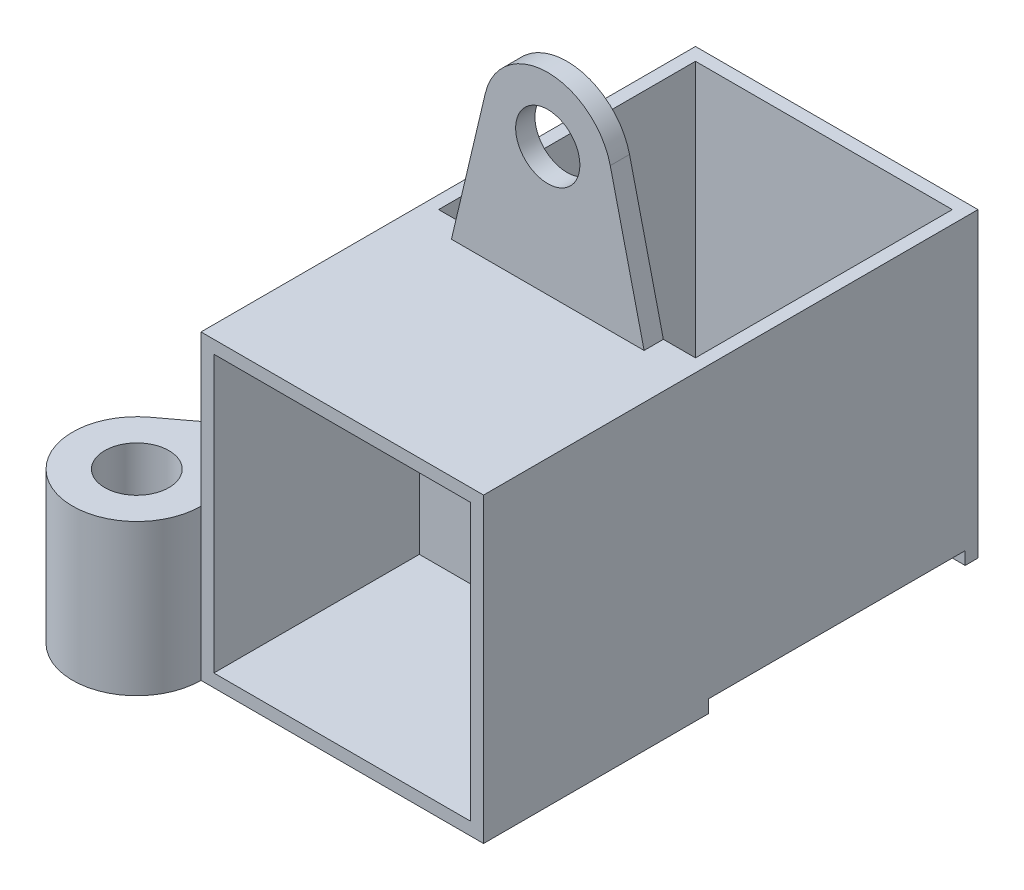
from build123d import *

# Parameters (mm, degrees)
SKETCH1_R                = 5
BOSS_EXTRUDE1_DEPTH      = 3
BOSS_EXTRUDE2_DEPTH      = 35
BOSS_EXTRUDE2_DEPTH_BACK = 40
BOSS_EXTRUDE2_START      = -3
SKETCH1_3_W              = 2
SKETCH1_3_H              = 45
SKETCH1_3_H_2            = 2
BOSS_EXTRUDE6_START      = -3
BOSS_EXTRUDE6_DEPTH      = 35
BOSS_EXTRUDE8_START      = -45
SKETCH1_7_W              = 44
SKETCH1_7_H              = 47
BOSS_EXTRUDE8_DEPTH      = 2
BOSS_EXTRUDE9_START      = -3
SKETCH1_8_W              = 2
SKETCH1_8_H              = 2
BOSS_EXTRUDE9_DEPTH      = 35
BOSS_EXTRUDE10_START     = -67
BOSS_EXTRUDE10_DEPTH     = 23.5
CUT_EXTRUDE1_START       = -43.5
SKETCH6_4_R              = 5
CUT_EXTRUDE1_DEPTH       = 48.48351499


with BuildPart() as part:
    # Sketch1 → Boss-Extrude1 (new body)
    with BuildSketch(Plane.XY):
        with BuildLine():
            Line((-9.732121112, 2.299090834), (-15, -20))
            Line((-15, -20), (-20, -20))
            Line((-20, -20), (-20, -65))
            Line((-20, -65), (20, -65))
            Line((20, -65), (20, -20))
            Line((20, -20), (15, -20))
            Line((15, -20), (9.732121112, 2.299090834))
            ThreePointArc((9.732121112, 2.299090834), (0, 10), (-9.732121112, 2.299090834))
        make_face()
        Circle(SKETCH1_R, mode=Mode.SUBTRACT)
    extrude(amount=-BOSS_EXTRUDE1_DEPTH)

    # Sketch1<3> → Boss-Extrude2 (add, two sides: drawn at the far end of the back side and taken through both)
    with BuildSketch(Plane.XY.offset(BOSS_EXTRUDE2_START - BOSS_EXTRUDE2_DEPTH_BACK)):
        with Locations((-21, -42.5)):
            Rectangle(SKETCH1_3_W, SKETCH1_3_H)
        with Locations((21, -42.5)):
            Rectangle(SKETCH1_3_W, SKETCH1_3_H)
        with Locations((-21, -21)):
            Rectangle(SKETCH1_3_W, SKETCH1_3_H_2)
        with Locations((21, -21)):
            Rectangle(SKETCH1_3_W, SKETCH1_3_H_2)
    extrude(amount=BOSS_EXTRUDE2_DEPTH + BOSS_EXTRUDE2_DEPTH_BACK)

    # Sketch1<4> → Boss-Extrude6 (add)
    with BuildSketch(Plane.XY.offset(BOSS_EXTRUDE6_START)):
        Polygon((22, -65), (22, -67), (-22, -67), (-22, -65), (-20, -65), (20, -65), align=None)
    extrude(amount=BOSS_EXTRUDE6_DEPTH)

    # Sketch1<7> → Boss-Extrude8 (add)
    with BuildSketch(Plane.XY.offset(BOSS_EXTRUDE8_START)):
        with Locations((0, -43.5)):
            Rectangle(SKETCH1_7_W, SKETCH1_7_H)
    extrude(amount=BOSS_EXTRUDE8_DEPTH)

    # Sketch1<8> → Boss-Extrude9 (add)
    with BuildSketch(Plane.XY.offset(BOSS_EXTRUDE9_START)):
        Polygon((15, -20), (-15, -20), (-20, -20), (-20, -22), (20, -22), (20, -20), align=None)
        with Locations((21, -21)):
            Rectangle(SKETCH1_8_W, SKETCH1_8_H)
        with Locations((-21, -21)):
            Rectangle(SKETCH1_8_W, SKETCH1_8_H)
    extrude(amount=BOSS_EXTRUDE9_DEPTH)


with BuildPart() as body_2:
    # Sketch6 → Boss-Extrude10 (new body)
    with BuildSketch(Plane(origin=(0, 0, 0), x_dir=(1, 0, 0), z_dir=(0, 1, 0)).offset(BOSS_EXTRUDE10_START)):
        with BuildLine():
            Line((-22, -12), (-38, -24))
            ThreePointArc((-38, -24), (-36.472135955, -40.94427191), (-22, -32))
            Line((-22, -32), (-22, -12))
        make_face()
    extrude(amount=BOSS_EXTRUDE10_DEPTH)

    # Sketch6<4> → Cut-Extrude1 (cut, through all)
    with BuildSketch(Plane(origin=(0, 0, 0), x_dir=(1, 0, 0), z_dir=(0, 1, 0)).offset(CUT_EXTRUDE1_START)):
        with Locations(Location((-32, -32, 0), (0, 0, 270))):
            Circle(SKETCH6_4_R)
    extrude(amount=-CUT_EXTRUDE1_DEPTH, mode=Mode.SUBTRACT)


solid = Compound([part.part, body_2.part])
